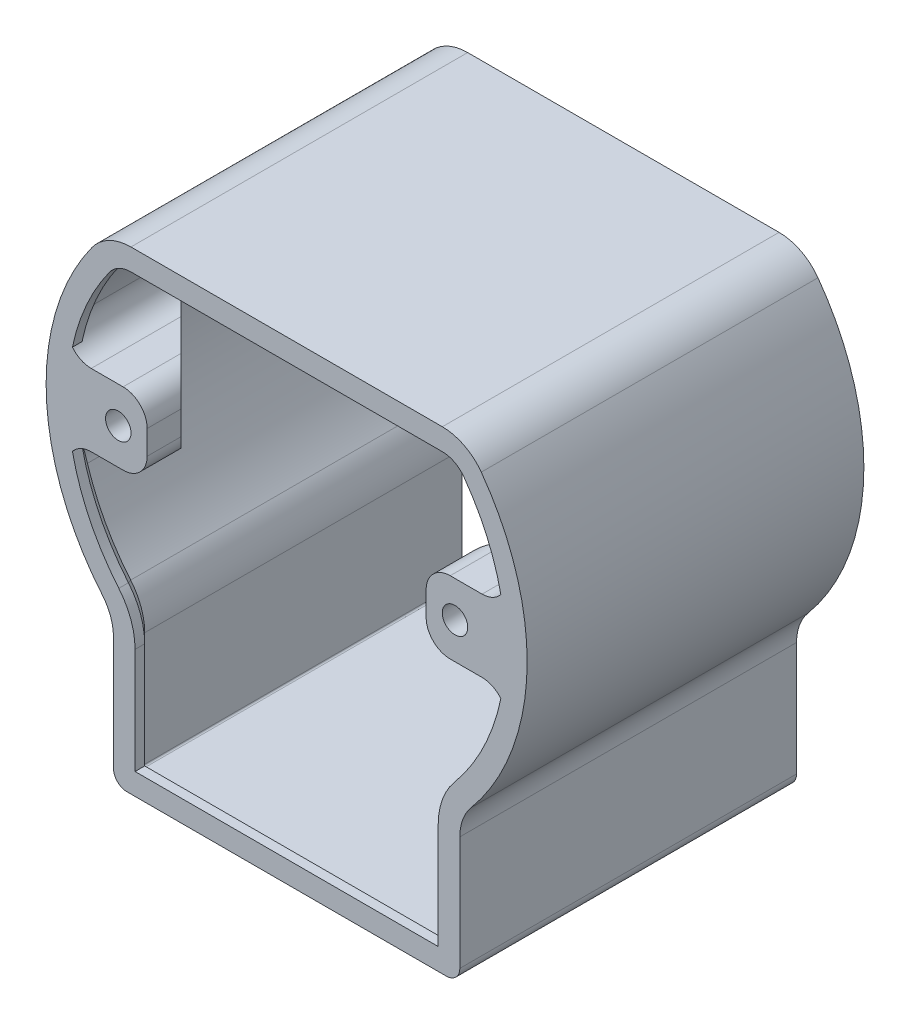
from build123d import *

# Parameters (mm, degrees)
LINEAR_AUSTRAGEN_D_NN1_DEPTH                = 70
AUFSATZ_LINEAR_AUSTRAGEN3_REACH             = 138.819
AUFSATZ_LINEAR_START                        = 29
SKIZZE6_W                                   = 25
SKIZZE6_H                                   = 15
FASE1_SIZE                                  = 18
SKIZZE7_R                                   = 2.65
SCHNITT_LINEAR_AUSTRAGEN3_DEPTH             = 108.819293264
SCHNITT_LINEAR_START                        = -5
SCHNITT_LINEAR_AUSTRAGEN5_DEPTH             = 90
VERRUNDUNG1_R                               = 5
AUFSATZ_LINEAR_AUSTRAGEN5_REACH             = 109.819
AUFSATZ_LINEAR_AUSTRAGEN5_DIRECTION_2_REACH = 109.819


with BuildPart() as part:
    # Skizze1 → Linear-Austragen-Dünn1 (new body)
    with BuildSketch(Plane.XY):
        with BuildLine():
            Line((-33.2, -65), (0, -65))
            Line((0, -65), (33.2, -65))
            ThreePointArc((33.2, -65), (35.179898987, -64.179898987), (36, -62.2))
            Line((36, -62.2), (36, -38.522720569))
            ThreePointArc((36, -38.522720569), (36.601418547, -35.107070313), (38.333333333, -32.10226714))
            ThreePointArc((38.333333333, -32.10226714), (49.970076451, -1.729583607), (40.461208274, 29.375))
            ThreePointArc((40.461208274, 29.375), (36.91044215, 32.409264841), (32.368966619, 33.5))
            Line((32.368966619, 33.5), (0, 33.5))
            Line((0, 33.5), (-32.368966619, 33.5))
            ThreePointArc((-32.368966619, 33.5), (-36.91044215, 32.409264841), (-40.461208274, 29.375))
            ThreePointArc((-40.461208274, 29.375), (-49.970076451, -1.729583607), (-38.333333333, -32.10226714))
            ThreePointArc((-38.333333333, -32.10226714), (-36.601418547, -35.107070313), (-36, -38.522720569))
            Line((-36, -38.522720569), (-36, -62.2))
            ThreePointArc((-36, -62.2), (-35.179898987, -64.179898987), (-33.2, -65))
        make_face()
        with BuildLine():
            Line((-33.2, -62.51), (0, -62.51))
            Line((0, -62.51), (33.2, -62.51))
            ThreePointArc((33.2, -62.51), (33.419203102, -62.419203102), (33.51, -62.2))
            Line((33.51, -62.2), (33.51, -38.522720569))
            ThreePointArc((33.51, -38.522720569), (34.261171765, -34.2565734), (36.424333333, -30.503574237))
            ThreePointArc((36.424333333, -30.503574237), (47.481566644, -1.643450344), (38.446240102, 27.912125))
            ThreePointArc((38.446240102, 27.912125), (35.779614743, 30.190857895), (32.368966619, 31.01))
            Line((32.368966619, 31.01), (0, 31.01))
            Line((0, 31.01), (-32.368966619, 31.01))
            ThreePointArc((-32.368966619, 31.01), (-35.779614743, 30.190857895), (-38.446240102, 27.912125))
            ThreePointArc((-38.446240102, 27.912125), (-47.481566644, -1.643450344), (-36.424333333, -30.503574237))
            ThreePointArc((-36.424333333, -30.503574237), (-34.261171765, -34.2565734), (-33.51, -38.522720569))
            Line((-33.51, -38.522720569), (-33.51, -62.2))
            ThreePointArc((-33.51, -62.2), (-33.419203102, -62.419203102), (-33.2, -62.51))
        make_face(mode=Mode.SUBTRACT)
    extrude(amount=LINEAR_AUSTRAGEN_D_NN1_DEPTH)

    # Austragung2: sweep along a path in Skizze16
    with BuildLine(Plane.XY.offset(70)) as austragung2_path:
        Line((33.51, -62.2), (33.51, -38.522720569))
        ThreePointArc((33.51, -38.522720569), (34.261171765, -34.2565734), (36.424333333, -30.503574237))
        ThreePointArc((36.424333333, -30.503574237), (47.481566644, -1.643450344), (38.446240102, 27.912125))
        ThreePointArc((38.446240102, 27.912125), (35.779614743, 30.190857895), (32.368966619, 31.01))
        Line((32.368966619, 31.01), (-32.368966619, 31.01))
        ThreePointArc((-32.368966619, 31.01), (-35.779614743, 30.190857895), (-38.446240102, 27.912125))
        ThreePointArc((-38.446240102, 27.912125), (-47.481566644, -1.643450344), (-36.424333333, -30.503574237))
        ThreePointArc((-36.424333333, -30.503574237), (-34.261171765, -34.2565734), (-33.51, -38.522720569))
        Line((-33.51, -38.522720569), (-33.51, -62.2))
    # Skizze17 → Austragung2 (sweep)
    with BuildSketch(Plane(origin=(0, 0, 0), x_dir=(0, 0, -1), z_dir=(1, 0, 0))):
        Polygon((-70, 31.01), (-70, 29.01), (-68, 29.01), (-66, 31.01), align=None)
    sweep(path=austragung2_path.line)

    # Skizze6 → Aufsatz-Linear austragen3 (add, up to next)
    with BuildSketch(Plane(origin=(0, 0, 0), x_dir=(0, 0, -1), z_dir=(1, 0, 0)).offset(AUFSATZ_LINEAR_START), mode=Mode.PRIVATE) as aufsatz_linear_austragen3_sk1:
        with Locations((-57.5, 0)):
            Rectangle(SKIZZE6_W, SKIZZE6_H)
    aufsatz_linear_austragen3_tool1 = extrude(aufsatz_linear_austragen3_sk1.sketch, amount=AUFSATZ_LINEAR_AUSTRAGEN3_REACH, mode=Mode.PRIVATE) - part.part
    # Skizze6 → Aufsatz-Linear austragen3 (add, up to next)
    with BuildSketch(Plane(origin=(0, 0, 0), x_dir=(0, 0, -1), z_dir=(1, 0, 0)).offset(AUFSATZ_LINEAR_START), mode=Mode.PRIVATE) as aufsatz_linear_austragen3_sk2:
        with Locations((-12.5, 0)):
            Rectangle(SKIZZE6_W, SKIZZE6_H)
    aufsatz_linear_austragen3_tool2 = extrude(aufsatz_linear_austragen3_sk2.sketch, amount=AUFSATZ_LINEAR_AUSTRAGEN3_REACH, mode=Mode.PRIVATE) - part.part
    aufsatz_linear_austragen3_1 = aufsatz_linear_austragen3_tool1.solids().sort_by_distance((29, 0, 57.5))[0]
    add(aufsatz_linear_austragen3_1)
    aufsatz_linear_austragen3_2 = aufsatz_linear_austragen3_tool2.solids().sort_by_distance((29, 0, 12.5))[0]
    add(aufsatz_linear_austragen3_2)
    aufsatz_linear_austragen3 = aufsatz_linear_austragen3_1 + aufsatz_linear_austragen3_2  # Aufsatz-Linear austragen3 as one shape, for the pattern or mirror that repeats it

    # Spiegeln1: Aufsatz-Linear austragen3 across plane
    add(aufsatz_linear_austragen3.mirror(Plane(origin=(0, 0, 0), x_dir=(0, 0, 1), z_dir=(1, 0, 0))))

    # Fase1
    fase1_edges = [part.edges().sort_by_distance(p)[0] for p in [
        (29, 0, 45),
        (-29, 0, 45),
        (29, 0, 25),
        (-29, 0, 25),
    ]]
    chamfer(fase1_edges, length=FASE1_SIZE)

    # Skizze7 → Schnitt-Linear austragen3 (cut, through all)
    with BuildSketch(Plane.XY.offset(70)):
        with Locations((-35, 0)):
            Circle(SKIZZE7_R)
        with Locations((35, 0)):
            Circle(SKIZZE7_R)
    extrude(amount=-SCHNITT_LINEAR_AUSTRAGEN3_DEPTH, mode=Mode.SUBTRACT)

    # Skizze9 → Schnitt-Linear austragen5 (cut)
    with BuildSketch(Plane.XY.offset(70).offset(SCHNITT_LINEAR_START)):
        Polygon((-39.618802154, 0), (-37.309401077, -4), (-32.690598923, -4), (-30.381197846, 0), (-32.690598923, 4), (-37.309401077, 4), align=None)
        Polygon((30.381197846, 0), (32.690598923, -4), (37.309401077, -4), (39.618802154, 0), (37.309401077, 4), (32.690598923, 4), align=None)
    extrude(amount=-SCHNITT_LINEAR_AUSTRAGEN5_DEPTH, mode=Mode.SUBTRACT)

    # Verrundung1
    verrundung1_edges = [part.edges().sort_by_distance(p)[0] for p in [
        (-46.914284605, 7.5, 55.542857697),
        (-29, 7.5, 66.5),
        (-29, -7.5, 66.5),
        (-46.914284605, -7.5, 55.542857697),
        (46.914284605, -7.5, 55.542857697),
        (29, -7.5, 66.5),
        (29, 7.5, 66.5),
        (46.914284605, 7.5, 55.542857697),
        (-46.914284605, -7.5, 12.457142303),
        (-29, -7.5, 3.5),
        (-29, 7.5, 3.5),
        (-46.914284605, 7.5, 12.457142303),
        (46.914284605, -7.5, 12.457142303),
        (29, -7.5, 3.5),
        (29, 7.5, 3.5),
        (46.914284605, 7.5, 12.457142303),
    ]]
    fillet(verrundung1_edges, radius=VERRUNDUNG1_R)

    # Skizze17<3> → Aufsatz-Linear austragen5 (add, up to next)
    with BuildSketch(Plane(origin=(0, 0, 0), x_dir=(0, 0, -1), z_dir=(1, 0, 0)), mode=Mode.PRIVATE) as aufsatz_linear_austragen5_sk1:
        Polygon((-68, -60.51), (-66, -62.51), (-70, -62.51), (-70, -60.51), align=None)
    aufsatz_linear_austragen5_tool1 = extrude(aufsatz_linear_austragen5_sk1.sketch, amount=-AUFSATZ_LINEAR_AUSTRAGEN5_REACH, mode=Mode.PRIVATE) - part.part
    add(aufsatz_linear_austragen5_tool1.solids().sort_by_distance((0, -61.621111, 68.444444))[0])

    # Skizze17<3> → Aufsatz-Linear austragen5 direction 2 (add, up to next)
    with BuildSketch(Plane(origin=(0, 0, 0), x_dir=(0, 0, -1), z_dir=(1, 0, 0)), mode=Mode.PRIVATE) as aufsatz_linear_austragen5_direction_2_sk1:
        Polygon((-68, -60.51), (-66, -62.51), (-70, -62.51), (-70, -60.51), align=None)
    aufsatz_linear_austragen5_direction_2_tool1 = extrude(aufsatz_linear_austragen5_direction_2_sk1.sketch, amount=AUFSATZ_LINEAR_AUSTRAGEN5_DIRECTION_2_REACH, mode=Mode.PRIVATE) - part.part
    add(aufsatz_linear_austragen5_direction_2_tool1.solids().sort_by_distance((0, -61.621111, 68.444444))[0])


solid = part.part
